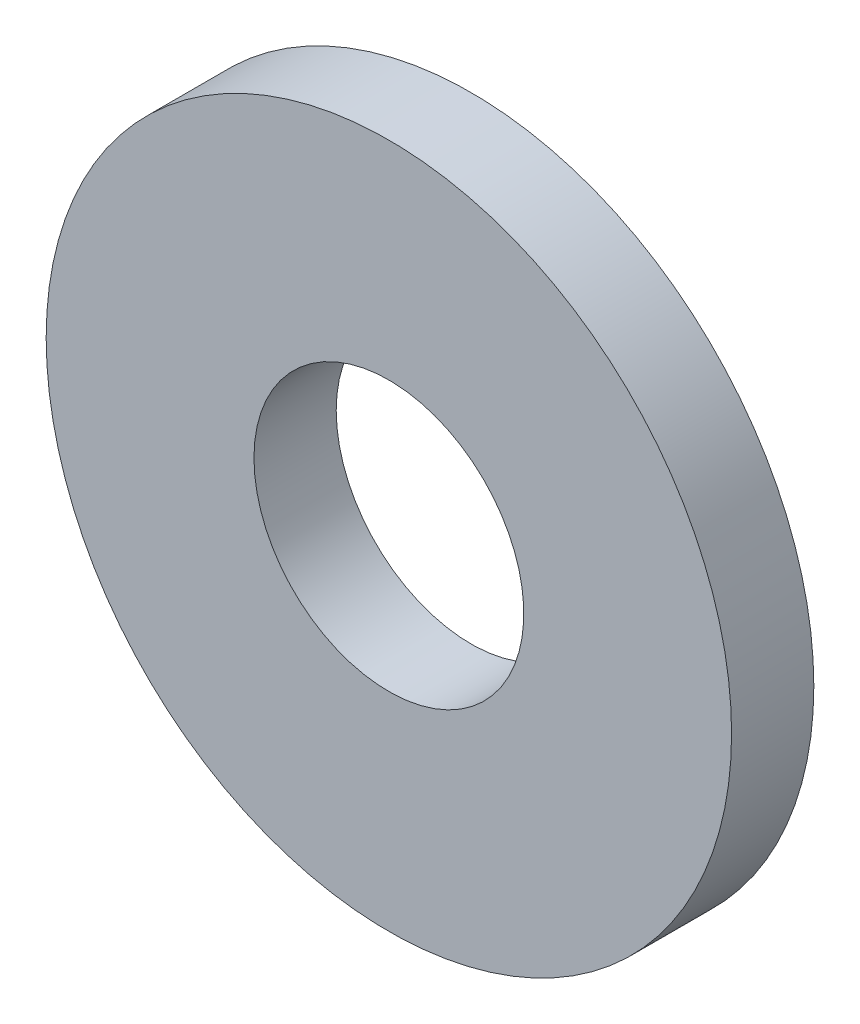
from build123d import *

# Parameters (mm, degrees)
SKETCH1_R           = 6.35
SKETCH1_R_2         = 2.5
BOSS_EXTRUDE1_DEPTH = 1.524


with BuildPart() as part:
    # Sketch1 → Boss-Extrude1 (new body)
    with BuildSketch(Plane.XY):
        with Locations(Location((0, 0, 0), (0, 0, 180))):
            Circle(SKETCH1_R)
        with Locations(Location((0, 0, 0), (0, 0, 180))):
            Circle(SKETCH1_R_2, mode=Mode.SUBTRACT)
    extrude(amount=BOSS_EXTRUDE1_DEPTH)


solid = part.part
